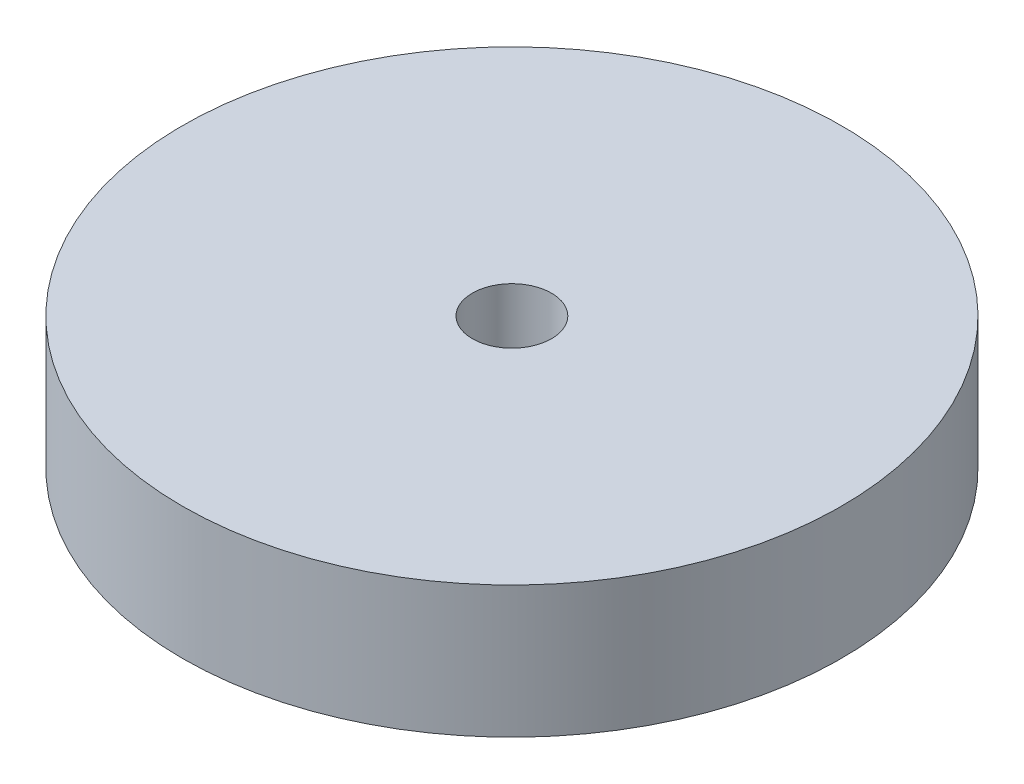
from build123d import *

# Parameters (mm, degrees)
SKETCH1_R           = 25
SKETCH1_R_2         = 3
BOSS_EXTRUDE1_DEPTH = 5


with BuildPart() as part:
    # Sketch1 → Boss-Extrude1 (new, symmetric)
    with BuildSketch(Plane(origin=(0, 0, 0), x_dir=(1, 0, 0), z_dir=(0, 1, 0))):
        with Locations(Location((0, 0, 0), (0, 0, 270))):
            Circle(SKETCH1_R)
        with Locations(Location((0, 0, 0), (0, 0, 270))):
            Circle(SKETCH1_R_2, mode=Mode.SUBTRACT)
    extrude(amount=BOSS_EXTRUDE1_DEPTH, both=True)


solid = part.part
